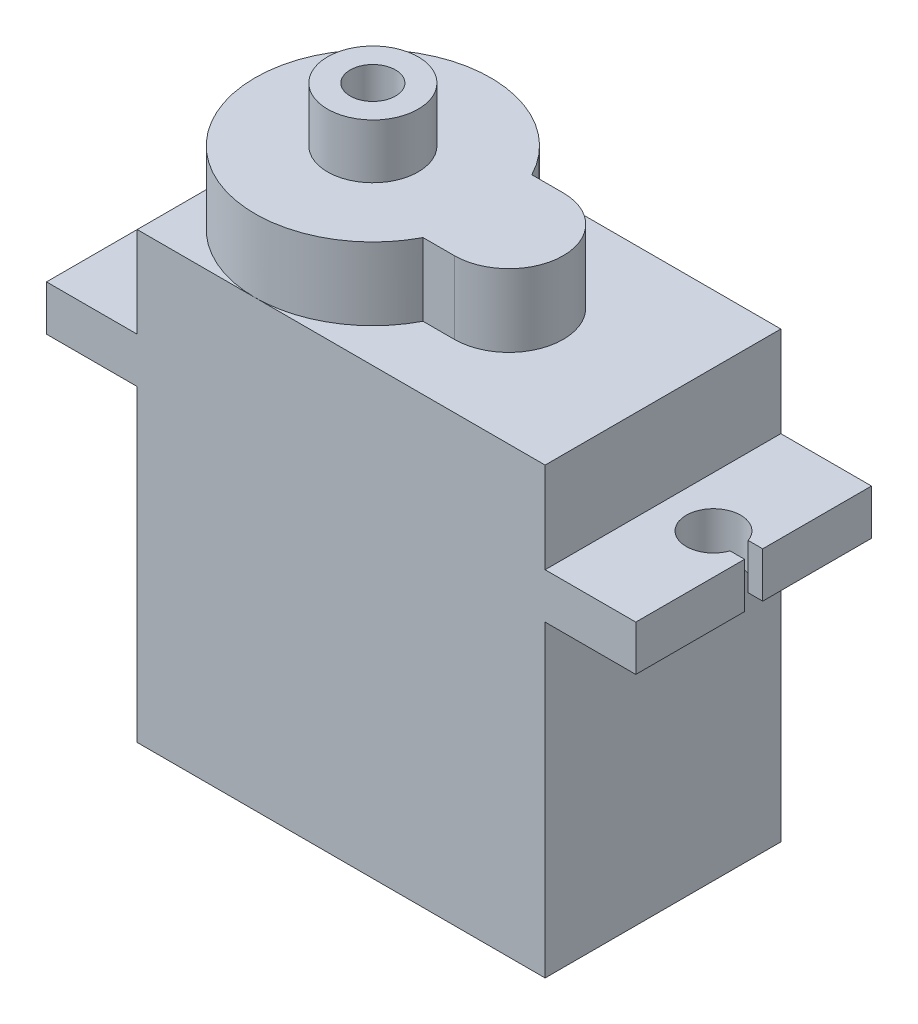
from build123d import *

# Parameters (mm, degrees)
BOSS_EXTRUDE1_DEPTH      = 6.5
BOSS_EXTRUDE1_DEPTH_BACK = 6.5
BOSS_EXTRUDE2_DEPTH      = 4
SKETCH4_R                = 2.5
SKETCH4_R_2              = 1.25
BOSS_EXTRUDE3_DEPTH      = 3
CUT_EXTRUDE1_DEPTH       = 29.901773302
CUT_EXTRUDE1_DEPTH_BACK  = 29.901773302


with BuildPart() as part:
    # Sketch1 → Boss-Extrude1 (new, two sides: drawn at the far end of the back side and taken through both)
    with BuildSketch(Plane.XY.offset(-BOSS_EXTRUDE1_DEPTH_BACK)):
        Polygon((-11.25, -8.5), (11.25, -8.5), (11.25, 8.5), (16.25, 8.5), (16.25, 11), (11.25, 11), (11.25, 16), (-11.25, 16), (-11.25, 11), (-16.25, 11), (-16.25, 8.5), (-11.25, 8.5), align=None)
    extrude(amount=BOSS_EXTRUDE1_DEPTH + BOSS_EXTRUDE1_DEPTH_BACK)

    # Sketch3 → Boss-Extrude2 (add)
    with BuildSketch(Plane(origin=(0, 16, 0), x_dir=(1, 0, 0), z_dir=(0, 1, 0))):
        with BuildLine():
            ThreePointArc((1.016281297, 3), (-11.25, 0), (1.016281297, -3))
            Line((1.016281297, -3), (2.75, -3))
            ThreePointArc((2.75, -3), (5.75, 0), (2.75, 3))
            Line((2.75, 3), (1.016281297, 3))
        make_face()
    extrude(amount=BOSS_EXTRUDE2_DEPTH)

    # Sketch4 → Boss-Extrude3 (add)
    with BuildSketch(Plane(origin=(0, 20, 0), x_dir=(1, 0, 0), z_dir=(0, 1, 0))):
        with Locations((-4.75, 0)):
            Circle(SKETCH4_R)
        with Locations((-4.75, 0)):
            Circle(SKETCH4_R_2, mode=Mode.SUBTRACT)
    extrude(amount=BOSS_EXTRUDE3_DEPTH)

    # Sketch5 → Cut-Extrude1 (cut, two sides: drawn at the far end of the back side and taken through both)
    with BuildSketch(Plane(origin=(0, 0, 0), x_dir=(1, 0, 0), z_dir=(0, 1, 0)).offset(-CUT_EXTRUDE1_DEPTH_BACK)):
        with BuildLine():
            Line((-16.25, 0.5), (-15.45, 0.5))
            ThreePointArc((-15.45, 0.5), (-12.535786438, 0), (-15.45, -0.5))
            Line((-15.45, -0.5), (-16.25, -0.5))
            Line((-16.25, -0.5), (-16.25, 0.5))
        make_face()
        with BuildLine():
            Line((16.25, -0.5), (15.45, -0.5))
            ThreePointArc((15.45, -0.5), (12.535786438, 0), (15.45, 0.5))
            Line((15.45, 0.5), (16.25, 0.5))
            Line((16.25, 0.5), (16.25, -0.5))
        make_face()
    extrude(amount=CUT_EXTRUDE1_DEPTH + CUT_EXTRUDE1_DEPTH_BACK, mode=Mode.SUBTRACT)


solid = part.part
